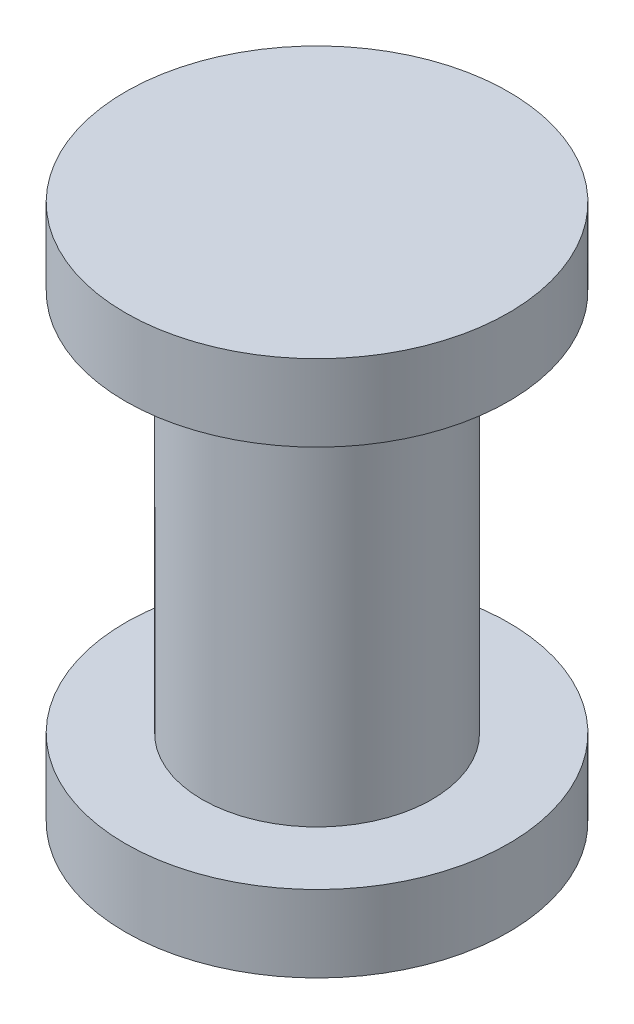
from build123d import *


with BuildPart() as part:
    # Sketch1 → Revolve1 (revolve)
    with BuildSketch(Plane.XY, mode=Mode.PRIVATE) as revolve1_sk:
        Polygon((-14.761543591, 26.948638362), (-17.261543591, 26.948638362), (-17.261543591, 25.948638362), (-16.261543591, 25.948638362), (-16.261543591, 20.948638362), (-17.261543591, 20.948638362), (-17.261543591, 19.948638362), (-14.761543591, 19.948638362), align=None)
    revolve(revolve1_sk.sketch.rotate(Axis((-14.761543591, 26.948638362, 0), (0, -1, 0)), 270), axis=Axis((-14.761543591, 26.948638362, 0), (0, -1, 0)))


solid = part.part
